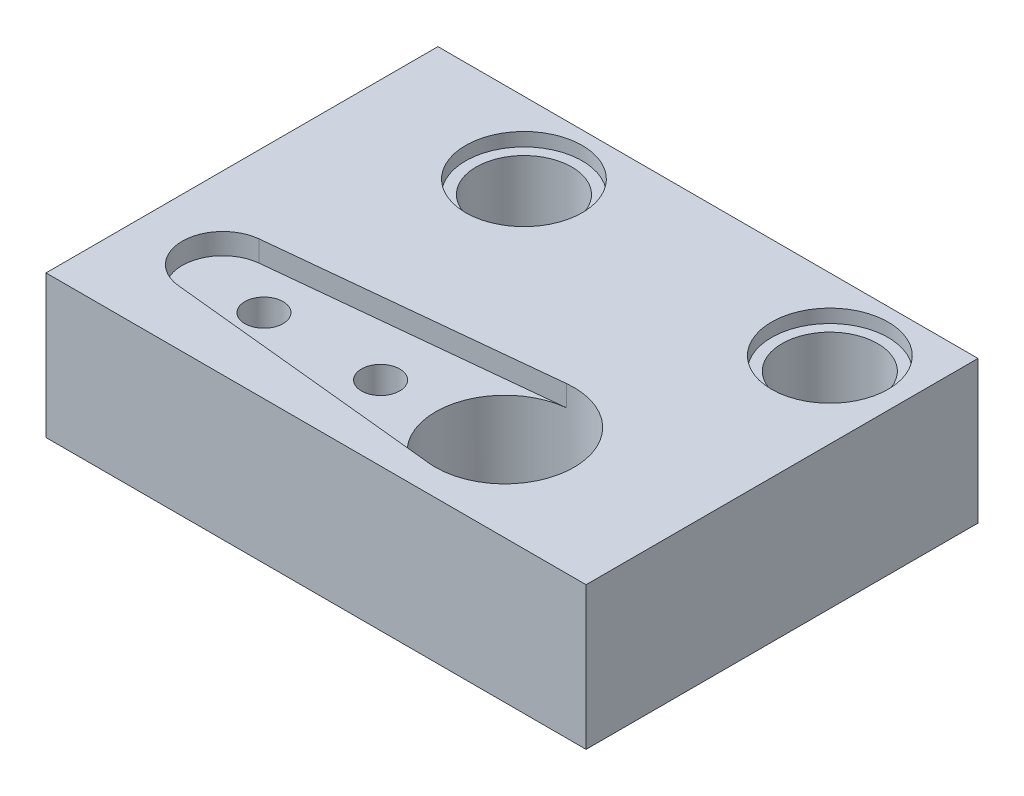
from build123d import *
from build123d.topology import SkipClean

# Parameters (mm, degrees)
SKETCH1_W           = 28.25
SKETCH1_H           = 20.5
SKETCH1_R           = 2.5
BOSS_EXTRUDE1_DEPTH = 7.46
CUT_EXTRUDE2_DEPTH  = 1.1
SKETCH5_R           = 1
SKETCH5_R_2         = 3.62054265
CUT_EXTRUDE3_DEPTH  = 26.331790304
SKETCH6_R           = 3.05
CUT_EXTRUDE4_DEPTH  = 0.7
CUT_EXTRUDE5_START  = -0.7
SKETCH7_R           = 3.05
CUT_EXTRUDE5_DEPTH  = 0.7


with BuildPart() as part:
    # Sketch1 → Boss-Extrude1 (new body)
    with BuildSketch(Plane(origin=(0, 0, 0), x_dir=(1, 0, 0), z_dir=(0, 1, 0))):
        with Locations((-4.875, 5.25)):
            Rectangle(SKETCH1_W, SKETCH1_H)
        with Locations(Location((5.25, 11.75, 0), (0, 0, 90))):
            Circle(SKETCH1_R, mode=Mode.SUBTRACT)
        with Locations(Location((-10.75, 11.75, 0), (0, 0, 90))):
            Circle(SKETCH1_R, mode=Mode.SUBTRACT)
    extrude(amount=BOSS_EXTRUDE1_DEPTH)

    # Sketch3 → Cut-Extrude2 (cut)
    with BuildSketch(Plane(origin=(0, 7.46, 0), x_dir=(1, 0, 0), z_dir=(0, 1, 0))):
        with BuildLine():
            Line((-14.965459534, 2.114048767), (-0.367096675, 3.601884106))
            ThreePointArc((-0.367096675, 3.601884106), (3.62054265, 0), (-0.367096675, -3.601884106))
            Line((-0.367096675, -3.601884106), (-14.965459534, -2.114048767))
            ThreePointArc((-14.965459534, -2.114048767), (-16.875, 0), (-14.965459534, 2.114048767))
        make_face()
    extrude(amount=-CUT_EXTRUDE2_DEPTH, mode=Mode.SUBTRACT)

    # Sketch5 → Cut-Extrude3 (cut, through all)
    with SkipClean():  # the faces are left unmerged after this step: merging them gives an invalid solid
        with BuildSketch(Plane(origin=(0, 6.36, 0), x_dir=(1, 0, 0), z_dir=(0, 1, 0))):
            with Locations(Location((-12.6, 0, 0), (0, 0, 270))):
                Circle(SKETCH5_R)
            with Locations(Location((-6.5, 0, 0), (0, 0, 270))):
                Circle(SKETCH5_R)
            with Locations(Location((0, 0, 0), (0, 0, 270))):
                Circle(SKETCH5_R_2)
        extrude(amount=-CUT_EXTRUDE3_DEPTH, mode=Mode.SUBTRACT)

    # Sketch6 → Cut-Extrude4 (cut)
    with SkipClean():  # the faces are left unmerged after this step: merging them gives an invalid solid
        with BuildSketch(Plane(origin=(0, 7.46, 0), x_dir=(1, 0, 0), z_dir=(0, 1, 0))):
            with Locations(Location((-10.75, 11.75, 0), (0, 0, 270))):
                Circle(SKETCH6_R)
            with Locations(Location((5.25, 11.75, 0), (0, 0, 270))):
                Circle(SKETCH6_R)
        extrude(amount=-CUT_EXTRUDE4_DEPTH, mode=Mode.SUBTRACT)

    # Sketch7 → Cut-Extrude5 (cut)
    with SkipClean():  # the faces are left unmerged after this step: merging them gives an invalid solid
        with BuildSketch(Plane.XZ.offset(CUT_EXTRUDE5_START)):
            with Locations(Location((5.25, -11.75, 0), (0, 0, 90))):
                Circle(SKETCH7_R)
            with Locations(Location((-10.75, -11.75, 0), (0, 0, 90))):
                Circle(SKETCH7_R)
        extrude(amount=CUT_EXTRUDE5_DEPTH, mode=Mode.SUBTRACT)


solid = part.part
